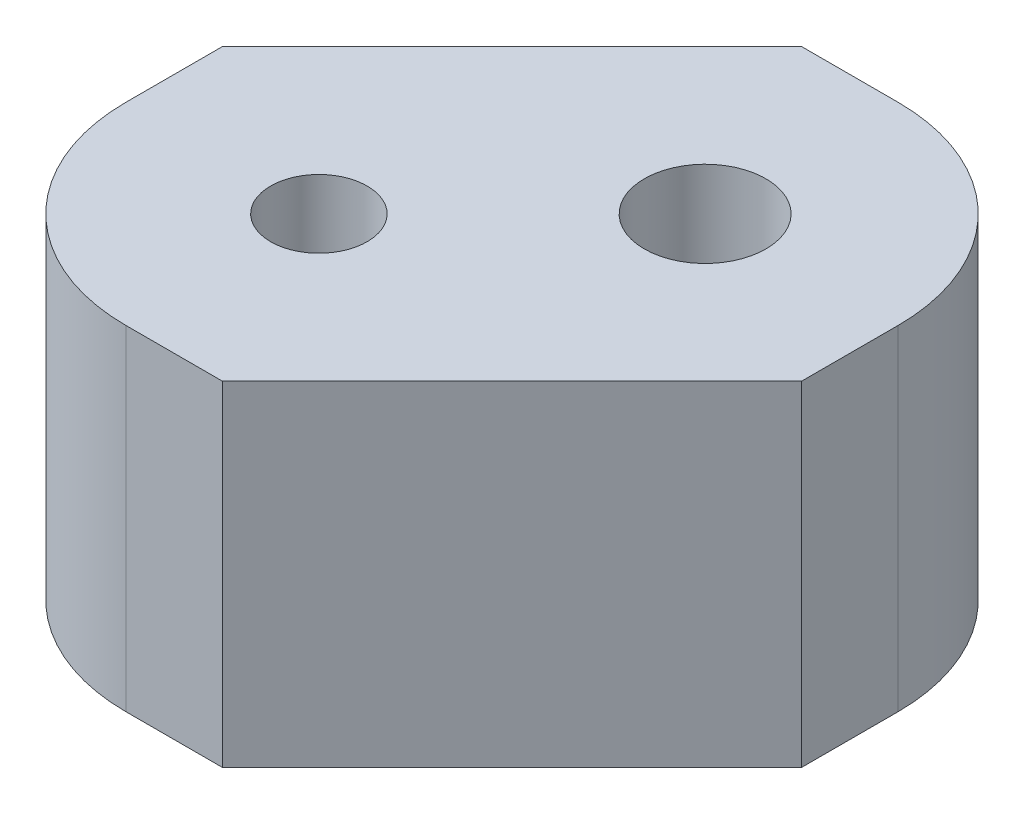
from build123d import *

# Parameters (mm, degrees)
SKETCH1_W           = 19.05
SKETCH1_H           = 19.05
BOSS_EXTRUDE1_DEPTH = 11
SKETCH2_R           = 1.5875
CUT_EXTRUDE1_DEPTH  = 18.39112561
SKETCH3_R           = 2
CUT_EXTRUDE2_DEPTH  = 5.7
SKETCH4_R           = 2
CUT_EXTRUDE3_DEPTH  = 5.7
CUT_EXTRUDE4_DEPTH  = 18.39112561
FILLET1_R           = 6.35


with BuildPart() as part:
    # Sketch1 → Boss-Extrude1 (new body)
    with BuildSketch(Plane(origin=(0, 0, 0), x_dir=(1, 0, 0), z_dir=(0, 1, 0))):
        Rectangle(SKETCH1_W, SKETCH1_H)
    extrude(amount=BOSS_EXTRUDE1_DEPTH)

    # Sketch2 → Cut-Extrude1 (cut, through all)
    with BuildSketch(Plane(origin=(0, 11, 0), x_dir=(1, 0, 0), z_dir=(0, 1, 0))):
        with Locations(Location((-3.175, -3.175, 0), (0, 0, 270))):
            Circle(SKETCH2_R)
        with Locations(Location((3.175, 3.175, 0), (0, 0, 270))):
            Circle(SKETCH2_R)
    extrude(amount=-CUT_EXTRUDE1_DEPTH, mode=Mode.SUBTRACT)

    # Sketch3 → Cut-Extrude2 (cut)
    with BuildSketch(Plane(origin=(0, 11, 0), x_dir=(1, 0, 0), z_dir=(0, 1, 0))):
        with Locations(Location((3.175, 3.175, 0), (0, 0, 270))):
            Circle(SKETCH3_R)
    extrude(amount=-CUT_EXTRUDE2_DEPTH, mode=Mode.SUBTRACT)

    # Sketch4 → Cut-Extrude3 (cut)
    with BuildSketch(Plane.XZ):
        with Locations(Location((-3.175, 3.175, 0), (0, 0, 270))):
            Circle(SKETCH4_R)
    extrude(amount=-CUT_EXTRUDE3_DEPTH, mode=Mode.SUBTRACT)

    # Sketch5 → Cut-Extrude4 (cut, through all)
    with BuildSketch(Plane(origin=(0, 11, 0), x_dir=(1, 0, 0), z_dir=(0, 1, 0))):
        Polygon((-9.525, 9.525), (0, 9.525), (-9.525, 0), align=None)
        Polygon((0, -9.525), (9.525, 0), (9.525, -9.525), align=None)
    extrude(amount=-CUT_EXTRUDE4_DEPTH, mode=Mode.SUBTRACT)

    # Fillet1
    fillet1_edges = [part.edges().sort_by_distance(p)[0] for p in [
        (-9.525, 5.5, 9.525),
        (9.525, 5.5, -9.525),
    ]]
    fillet(fillet1_edges, radius=FILLET1_R)


solid = part.part
